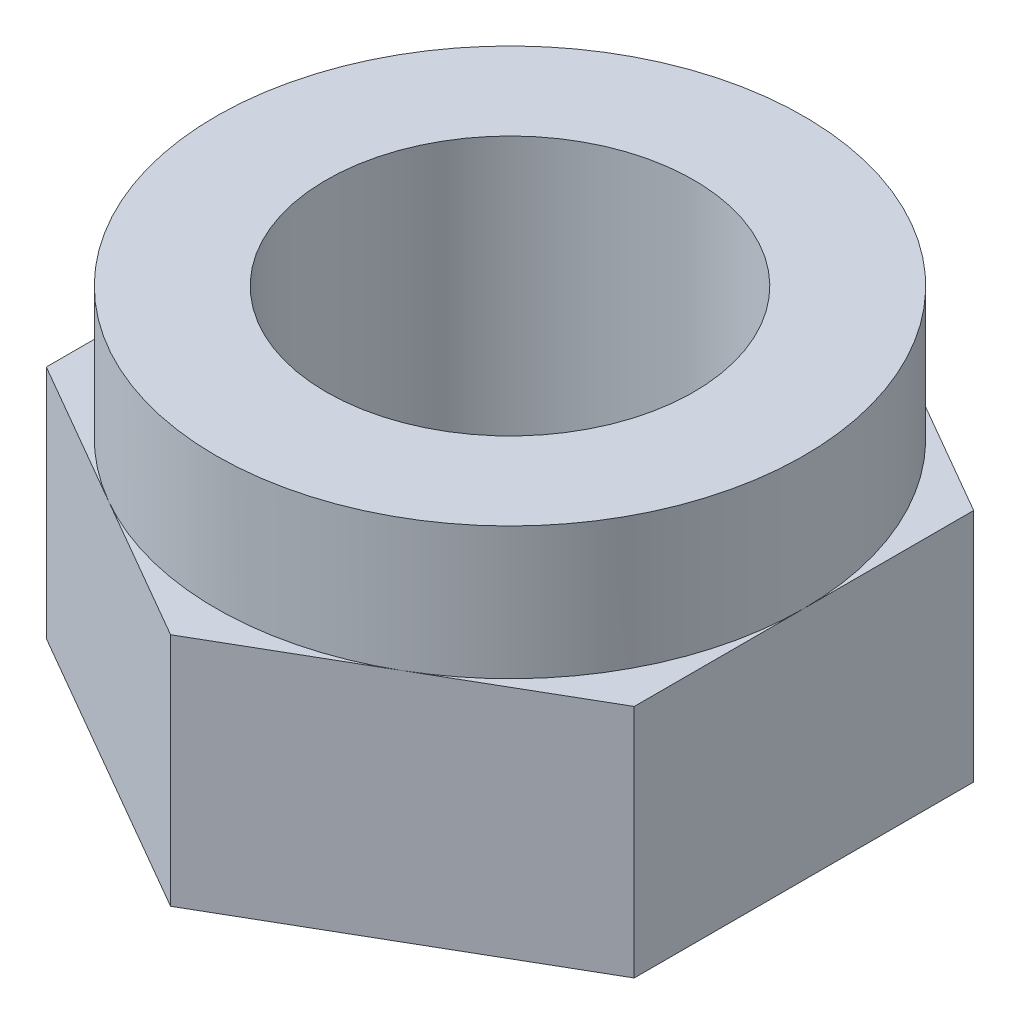
from build123d import *

# Parameters (mm, degrees)
SKETCH_1_R      = 2.5
EXTRUDE_1_DEPTH = 3.2
SKETCH_2_R      = 4
SKETCH_2_R_2    = 2.5
EXTRUDE_2_DEPTH = 1.8


with BuildPart() as part:
    # 草图1 → 凸台-拉伸1 (new body)
    with BuildSketch(Plane(origin=(0, 0, 0), x_dir=(1, 0, 0), z_dir=(0, 1, 0))):
        Polygon((0, -4.618802154), (4, -2.309401077), (4, 2.309401077), (0, 4.618802154), (-4, 2.309401077), (-4, -2.309401077), align=None)
        with Locations(Location((0, 0, 0), (0, 0, 270))):
            Circle(SKETCH_1_R, mode=Mode.SUBTRACT)
    extrude(amount=EXTRUDE_1_DEPTH)

    # 草图2 → 凸台-拉伸2 (add)
    with BuildSketch(Plane(origin=(0, 3.2, 0), x_dir=(1, 0, 0), z_dir=(0, 1, 0))):
        with Locations(Location((0, 0, 0), (0, 0, 60))):
            Circle(SKETCH_2_R)
        with Locations(Location((0, 0, 0), (0, 0, 270))):
            Circle(SKETCH_2_R_2, mode=Mode.SUBTRACT)
    extrude(amount=EXTRUDE_2_DEPTH)


solid = part.part
